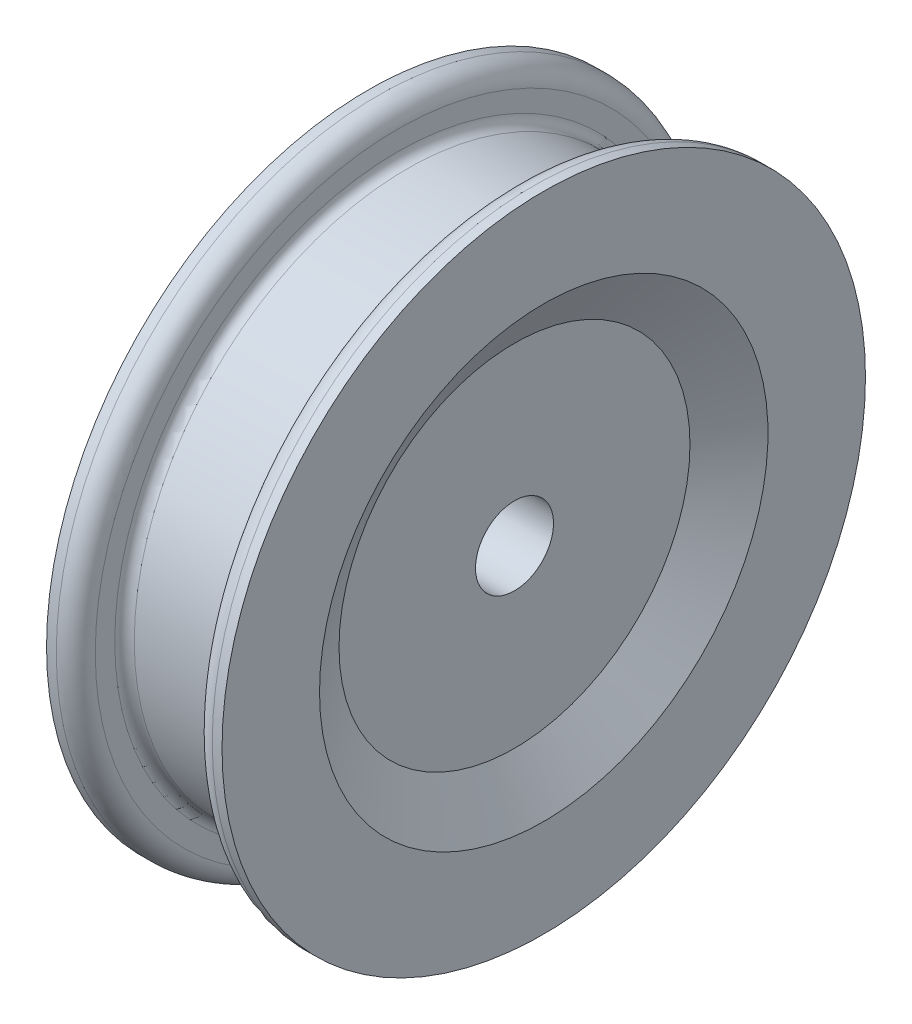
from build123d import *

# Parameters (mm, degrees)
FILLET1_R = 0.5


with BuildPart() as part:
    # Sketch1 → Revolve1 (revolve)
    with BuildSketch(Plane.XY, mode=Mode.PRIVATE) as revolve1_sk:
        with BuildLine():
            Line((-1.5, 1), (1.5, 1))
            Line((1.5, 1), (1.5, 4.5))
            Line((1.5, 4.5), (2.25, 5.75))
            Line((2.25, 5.75), (2.25, 8.25))
            Line((2.25, 8.25), (1.5, 8.25))
            Line((1.5, 8.25), (1.5, 7.25))
            ThreePointArc((1.5, 7.25), (1.426776695, 7.073223305), (1.25, 7))
            Line((1.25, 7), (-1.25, 7))
            ThreePointArc((-1.25, 7), (-1.426776695, 7.073223305), (-1.5, 7.25))
            Line((-1.5, 7.25), (-1.5, 8.25))
            Line((-1.5, 8.25), (-2.25, 8.25))
            Line((-2.25, 8.25), (-2.25, 5.75))
            Line((-2.25, 5.75), (-1.5, 4.5))
            Line((-1.5, 4.5), (-1.5, 1))
        make_face()
    revolve(revolve1_sk.sketch.rotate(Axis((0, 0, 0), (1, 0, 0)), 90), axis=Axis((0, 0, 0), (1, 0, 0)))

    # Fillet1
    fillet1_edges = [part.edges().sort_by_distance(p)[0] for p in [
        (-1.5, 0, -8.25),
        (1.5, 0, -8.25),
    ]]
    fillet(fillet1_edges, radius=FILLET1_R)


solid = part.part
